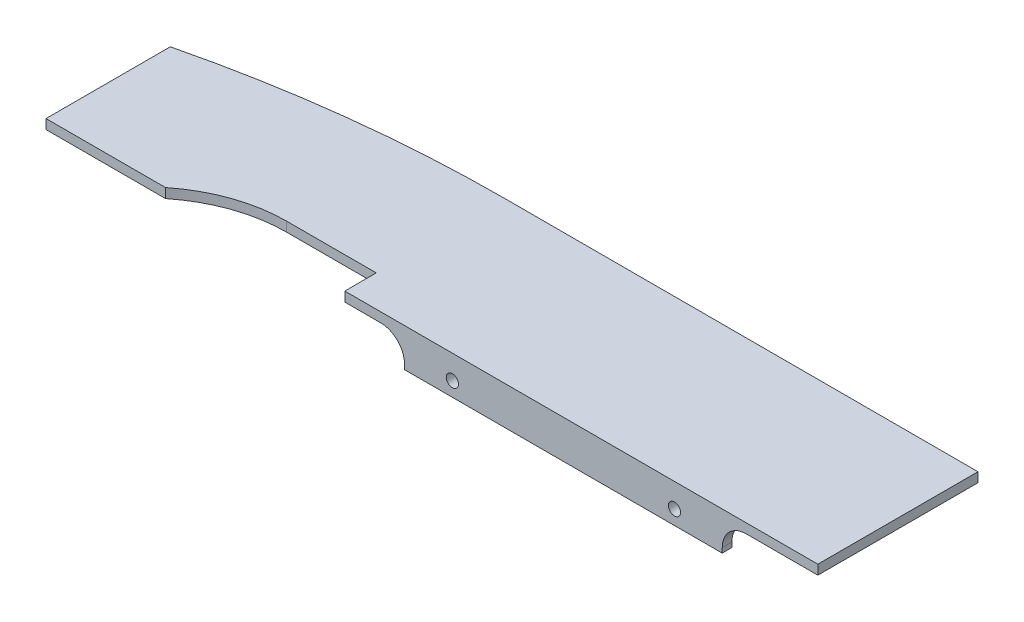
from build123d import *

# Parameters (mm, degrees)
SKETCH1_W           = 132.917449813
SKETCH1_H           = 12
SKETCH1_R           = 2.55
BOSS_EXTRUDE1_DEPTH = 4
SKETCH2_W           = 197.917449813
SKETCH2_H           = 67
BOSS_EXTRUDE2_DEPTH = 4
BOSS_EXTRUDE3_START = 4
SKETCH3_W           = 132.917449813
SKETCH3_H           = 12
SKETCH3_R           = 2.55
BOSS_EXTRUDE3_DEPTH = 4
FILLET1_R           = 10
FILLET2_R           = 2.5
BOSS_EXTRUDE4_DEPTH = 4


with BuildPart() as part:
    # Sketch1 → Boss-Extrude1 (new body)
    with BuildSketch(Plane.XY):
        with Locations((-116.458724907, 49.8)):
            Rectangle(SKETCH1_W, SKETCH1_H)
        with Locations((-162.917449813, 49.8)):
            Circle(SKETCH1_R, mode=Mode.SUBTRACT)
        with Locations((-70, 49.8)):
            Circle(SKETCH1_R, mode=Mode.SUBTRACT)
    extrude(amount=BOSS_EXTRUDE1_DEPTH)

    # Sketch2 → Boss-Extrude2 (add)
    with BuildSketch(Plane(origin=(0, 55.8, 0), x_dir=(1, 0, 0), z_dir=(0, 1, 0))):
        with Locations((-108.958724907, -33.5)):
            Rectangle(SKETCH2_W, SKETCH2_H)
    extrude(amount=BOSS_EXTRUDE2_DEPTH)

    # Sketch3 → Boss-Extrude3 (add)
    with BuildSketch(Plane(origin=(0, 0, 67), x_dir=(-1, 0, 0), z_dir=(0, 0, -1)).offset(BOSS_EXTRUDE3_START)):
        with Locations((116.458724907, 49.8)):
            Rectangle(SKETCH3_W, SKETCH3_H)
        with Locations(Location((162.917449813, 49.8, 0), (0, 0, 180))):
            Circle(SKETCH3_R, mode=Mode.SUBTRACT)
        with Locations(Location((70, 49.8, 0), (0, 0, 180))):
            Circle(SKETCH3_R, mode=Mode.SUBTRACT)
    extrude(amount=-BOSS_EXTRUDE3_DEPTH)

    # Fillet1
    fillet1_edges = [part.edges().sort_by_distance(p)[0] for p in [
        (-182.917449813, 55.8, 65),
        (-50, 55.8, 65),
        (-182.917449813, 55.8, 2),
        (-50, 55.8, 2),
    ]]
    fillet(fillet1_edges, radius=FILLET1_R)

    # Fillet2
    fillet2_edges = [part.edges().sort_by_distance(p)[0] for p in [
        (-116.458724906, 55.8, 4),
        (-116.458724906, 55.8, 63),
    ]]
    fillet(fillet2_edges, radius=FILLET2_R)

    # Sketch4 → Boss-Extrude4 (add)
    with BuildSketch(Plane(origin=(0, 59.8, 0), x_dir=(1, 0, 0), z_dir=(0, 1, 0))):
        with BuildLine():
            Line((-207.917449813, -53.837484988), (-207.917449813, 0))
            ThreePointArc((-207.917449813, 0), (-270.865841373, -3.763403666), (-332.917449813, -15))
            Line((-332.917449813, -15), (-332.917449813, -67))
            Line((-332.917449813, -67), (-282.917449813, -67))
            ThreePointArc((-282.917449813, -67), (-265.288923094, -57.223665565), (-245.417449813, -53.837484988))
            Line((-245.417449813, -53.837484988), (-207.917449813, -53.837484988))
        make_face()
    extrude(amount=-BOSS_EXTRUDE4_DEPTH)


solid = part.part
